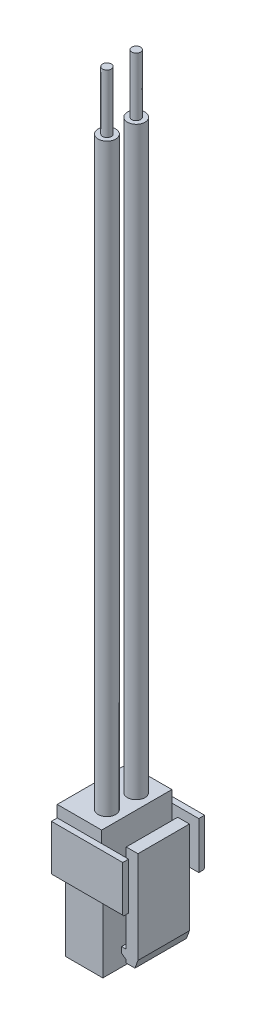
from build123d import *

# Parameters (mm, degrees)
BASE_EXTRUDE_DEPTH       = 4
SKETCH2_W                = 3.8
SKETCH2_H                = 6
BOSS_EXTRUDE1_DEPTH      = 1
SKETCH3_W                = 3.2
SKETCH3_H                = 5.8
BOSS_EXTRUDE2_DEPTH      = 6
BOSS_EXTRUDE3_DEPTH      = 2.2
WIRE_INSULATION_SKETCH_R = 0.75
WIRE_INSULATION_DEPTH    = 50
WIRE_SKETCH_R            = 0.375
WIRE_2_DEPTH             = 5
CHAMFER1_SIZE            = 0.1


with BuildPart() as part:
    # Sketch1 → Base-Extrude (new body)
    with BuildSketch(Plane(origin=(0, 0, 0), x_dir=(1, 0, 0), z_dir=(0, 1, 0))):
        Polygon((3.9, 3), (3.9, 3.5), (-2.2, 3.5), (-2.2, -3.5), (3.9, -3.5), (3.9, -3), (1.6, -3), (1.6, 3), align=None)
    extrude(amount=BASE_EXTRUDE_DEPTH)

    # Sketch2 → Boss-Extrude1 (add)
    with BuildSketch(Plane(origin=(0, 4, 0), x_dir=(-1, 0, 0), z_dir=(0, 1, 0))):
        with Locations((0.3, 0)):
            Rectangle(SKETCH2_W, SKETCH2_H)
    extrude(amount=BOSS_EXTRUDE1_DEPTH)

    # Sketch3 → Boss-Extrude2 (add)
    with BuildSketch(Plane.XZ):
        Rectangle(SKETCH3_W, SKETCH3_H)
    extrude(amount=BOSS_EXTRUDE2_DEPTH)

    # Sketch4 → Boss-Extrude3 (add, symmetric)
    with BuildSketch(Plane.XY):
        Polygon((1.6, 0), (1.6, 1), (2.9, 1), (2.9, 4), (3.9, 4), (3.9, -3.9), (3.645220836, -4.6), (2.9, -4.6), (2.9, -4.35), (2.5, -4.069916985), (2.5, -3.569916985), (2.9, -3.569916985), (2.9, 0), align=None)
    extrude(amount=BOSS_EXTRUDE3_DEPTH, both=True)

    # Wire Insulation Sketch → Wire Insulation (add)
    with BuildSketch(Plane(origin=(0, 5, 0), x_dir=(-1, 0, 0), z_dir=(0, 1, 0))):
        with Locations(Location((-0.3, 1.25, 0), (0, 0, 90))):
            Circle(WIRE_INSULATION_SKETCH_R)
        with Locations(Location((-0.3, -1.25, 0), (0, 0, 90))):
            Circle(WIRE_INSULATION_SKETCH_R)
    extrude(amount=WIRE_INSULATION_DEPTH)

    # Wire Sketch → Wire 2 (add)
    with BuildSketch(Plane(origin=(0, 55, 0), x_dir=(-1, 0, 0), z_dir=(0, 1, 0))):
        with Locations(Location((-0.3, -1.25, 0), (0, 0, 90))):
            Circle(WIRE_SKETCH_R)
        with Locations(Location((-0.3, 1.25, 0), (0, 0, 90))):
            Circle(WIRE_SKETCH_R)
    extrude(amount=WIRE_2_DEPTH)

    # Chamfer1
    chamfer1_edges = [part.edges().sort_by_distance(p)[0] for p in [
        (0.85, 0, 3.5),
        (-2.2, 0, 0),
        (0.85, 0, -3.5),
    ]]
    chamfer(chamfer1_edges, length=CHAMFER1_SIZE)


solid = part.part
